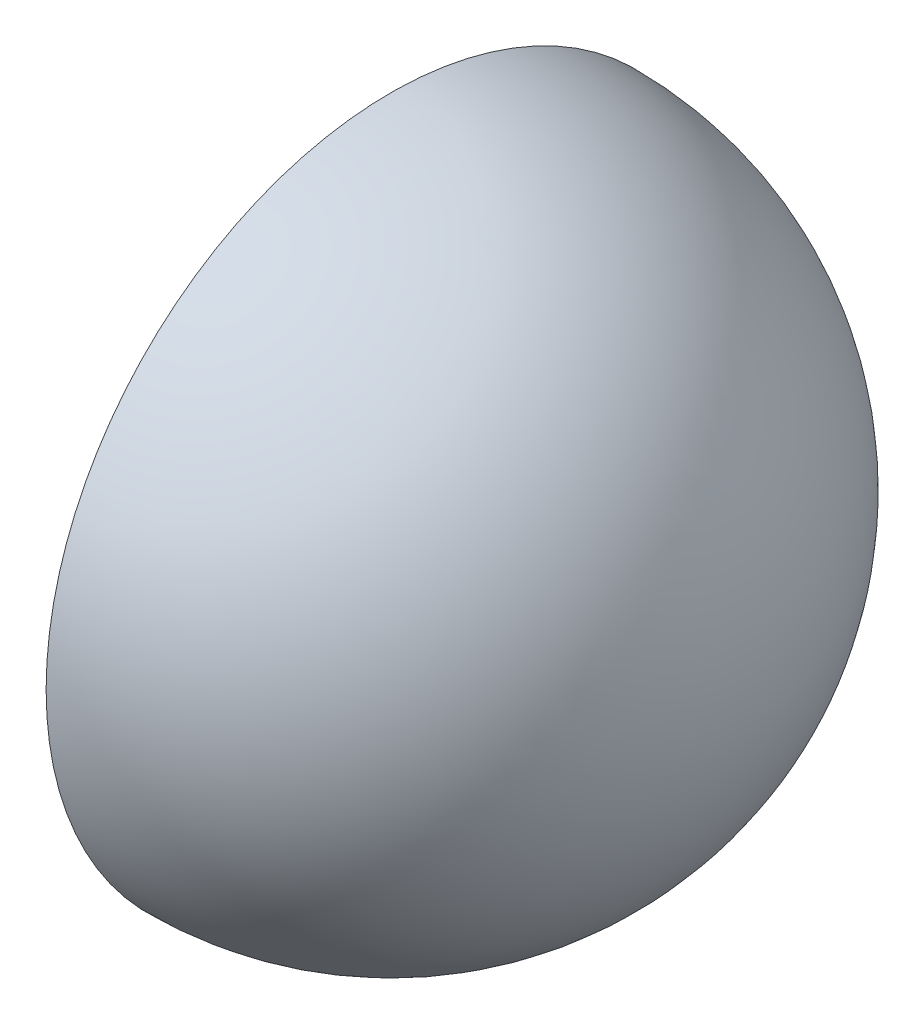
from build123d import *

# Parameters (mm, degrees)
REVOLVE_3_ANGLE = 180


with BuildPart() as part:
    # Эскиз1 → Повернуть3 (revolve)
    with BuildSketch(Plane(origin=(0, 0, 0), x_dir=(0, 0, -1), z_dir=(1, 0, 0))):
        with BuildLine():
            Line((0, 240), (0, 250))
            ThreePointArc((0, 250), (-250, 0), (0, -250))
            Line((0, -250), (0, -240))
            ThreePointArc((0, -240), (-240, 0), (0, 240))
        make_face()
    revolve(axis=Axis((0, 0, 0), (0, 1, 0)), revolution_arc=REVOLVE_3_ANGLE)


solid = part.part
